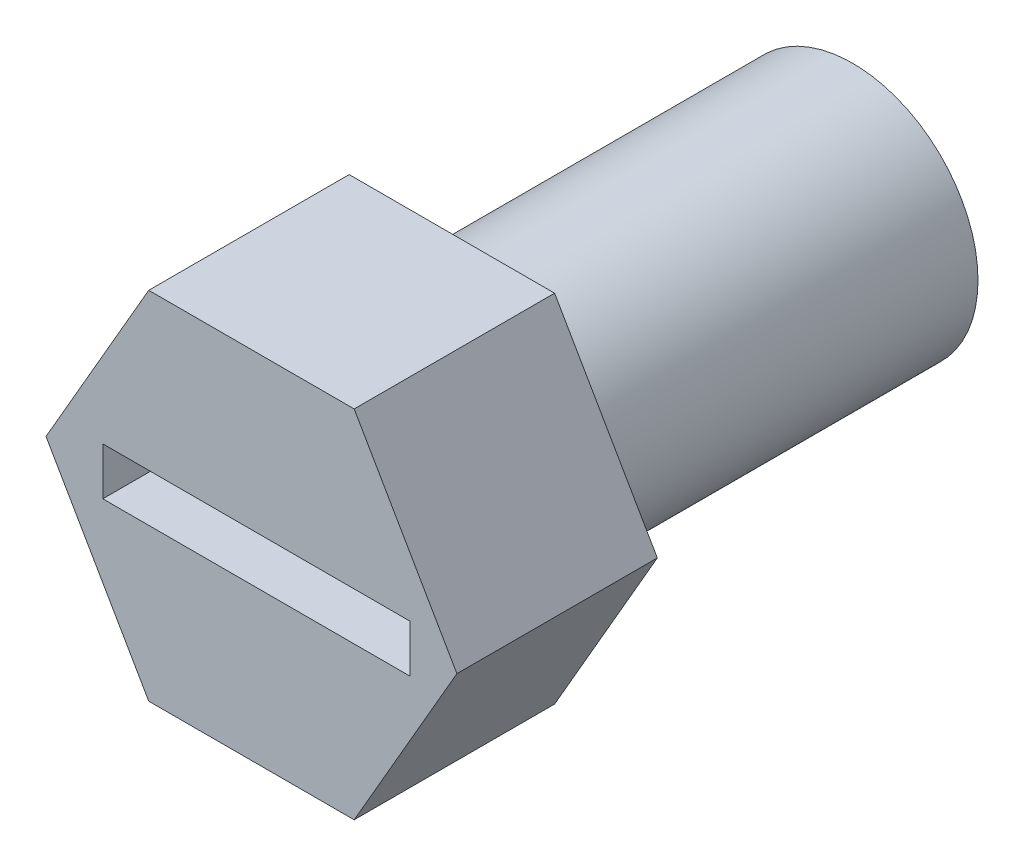
from build123d import *

# Parameters (mm, degrees)
SKETCH1_R           = 12.5
BOSS_EXTRUDE1_DEPTH = 40
BOSS_EXTRUDE2_DEPTH = 20
SKETCH3_W           = 30.675059353
SKETCH3_H           = 4.752473984
CUT_EXTRUDE1_DEPTH  = 15


with BuildPart() as part:
    # Sketch1 → Boss-Extrude1 (new body)
    with BuildSketch(Plane.XY):
        Circle(SKETCH1_R)
    extrude(amount=BOSS_EXTRUDE1_DEPTH)

    # Sketch2 → Boss-Extrude2 (add)
    with BuildSketch(Plane.XY.offset(40)):
        Polygon((20.501198272, 0), (10.250599136, 17.754558511), (-10.250599136, 17.754558511), (-20.501198272, 0), (-10.250599136, -17.754558511), (10.250599136, -17.754558511), align=None)
    extrude(amount=BOSS_EXTRUDE2_DEPTH)

    # Sketch3 → Cut-Extrude1 (cut)
    with BuildSketch(Plane.XY.offset(60)):
        with Locations((0.504050272, -0.180017954)):
            Rectangle(SKETCH3_W, SKETCH3_H)
    extrude(amount=-CUT_EXTRUDE1_DEPTH, mode=Mode.SUBTRACT)


solid = part.part
